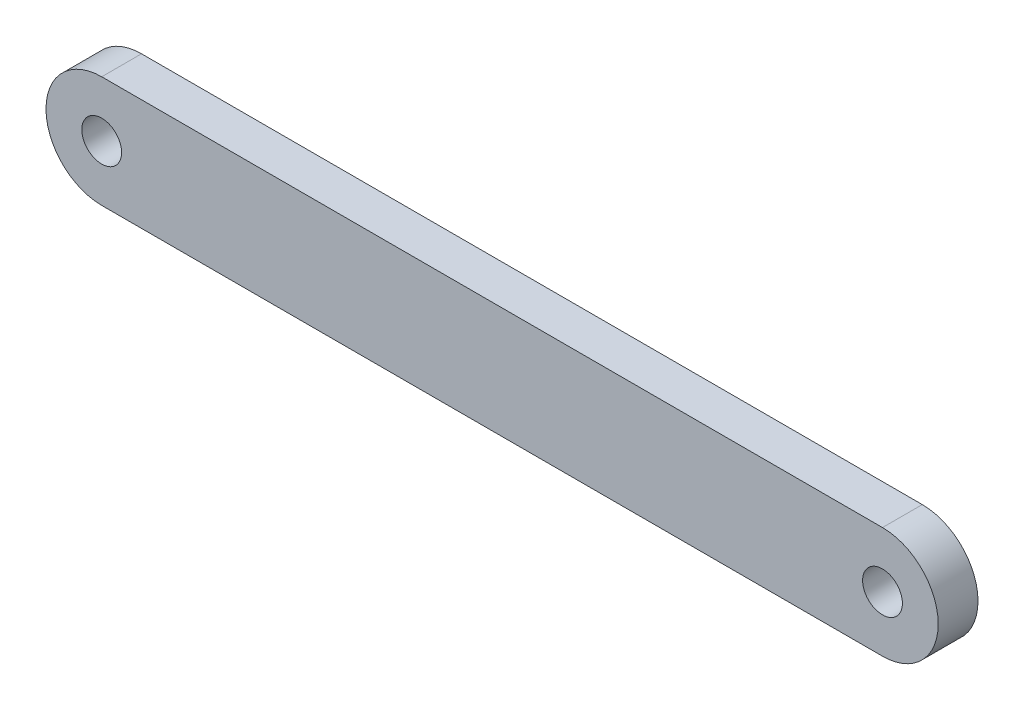
from build123d import *

# Parameters (mm, degrees)
SKETCH2_R           = 3.175
BOSS_EXTRUDE2_DEPTH = 6.35


with BuildPart() as part:
    # Sketch2 → Boss-Extrude2 (new body)
    with BuildSketch(Plane.XY):
        with BuildLine():
            Line((-63.195201668, -8.807106444), (61.388798332, -8.807106444))
            ThreePointArc((61.388798332, -8.807106444), (70.278798332, 0.082893556), (61.388798332, 8.972893556))
            Line((61.388798332, 8.972893556), (-63.195201668, 8.972893556))
            ThreePointArc((-63.195201668, 8.972893556), (-72.085201668, 0.082893556), (-63.195201668, -8.807106444))
        make_face()
        with Locations((-63.195201668, 0.082893556)):
            Circle(SKETCH2_R, mode=Mode.SUBTRACT)
        with Locations((61.388798332, 0.082893556)):
            Circle(SKETCH2_R, mode=Mode.SUBTRACT)
    extrude(amount=BOSS_EXTRUDE2_DEPTH)


solid = part.part
